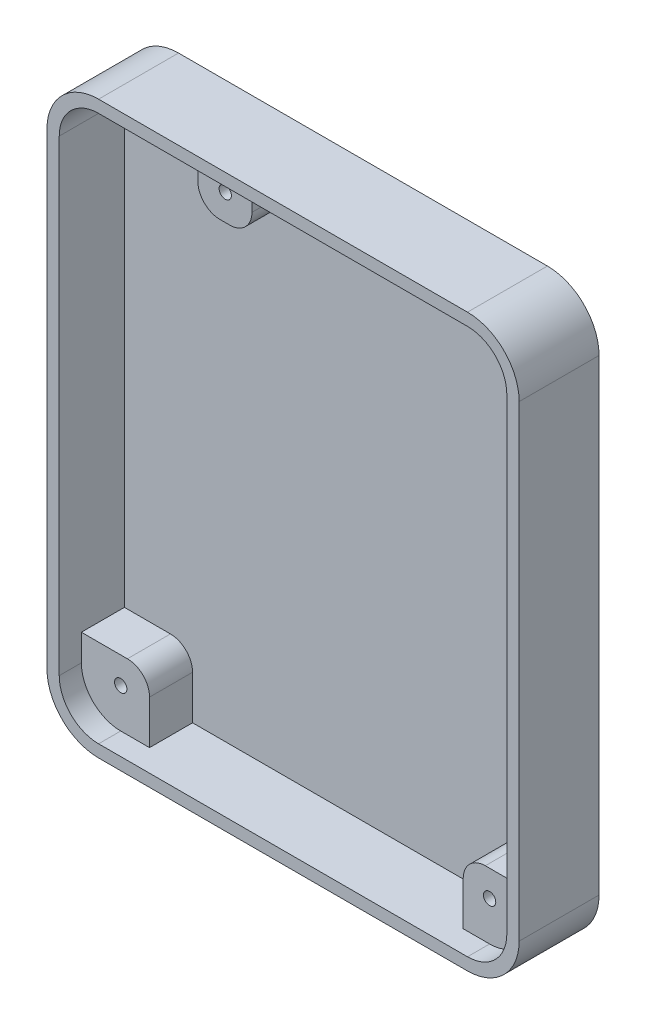
from build123d import *

# Parameters (mm, degrees)
EXTRUDE_1_DEPTH = 6.5
EXTRUDE_2_DEPTH = 1.2
SKETCH_4_R      = 0.5
EXTRUDE_3_DEPTH = 3.5


with BuildPart() as part:
    # Эскиз2 → Бобышка-Вытянуть1 (new body)
    with BuildSketch(Plane.XY):
        with BuildLine():
            Line((3.000001789, 45.2000009), (33.00000004, 45.2000009))
            ThreePointArc((33.00000004, 45.2000009), (35.969850924, 43.969847649), (37.20000166, 40.999995724))
            Line((37.20000166, 40.999995724), (37.20000166, 3.000004329))
            ThreePointArc((37.20000166, 3.000004329), (35.969850624, 0.030152951), (33.00000004, -1.2))
            Line((33.00000004, -1.2), (3.000001789, -1.2))
            ThreePointArc((3.000001789, -1.2), (0.030149154, 0.030152293), (-1.20000254, 3.000005176))
            Line((-1.20000254, 3.000005176), (-1.20000254, 40.999996571))
            ThreePointArc((-1.20000254, 40.999996571), (0.030149454, 43.969848906), (3.000001789, 45.2000009))
        make_face()
        with BuildLine():
            Line((3.000001789, 44.2000009), (33.00000004, 44.2000009))
            ThreePointArc((33.00000004, 44.2000009), (35.262743843, 43.262741167), (36.20000166, 40.999996571))
            Line((36.20000166, 40.999996571), (36.20000166, 3.000004329))
            ThreePointArc((36.20000166, 3.000004329), (35.262743843, 0.737259733), (33.00000004, -0.2))
            Line((33.00000004, -0.2), (3.000001789, -0.2))
            ThreePointArc((3.000001789, -0.2), (0.737256235, 0.737258775), (-0.20000254, 3.000004329))
            Line((-0.20000254, 3.000004329), (-0.20000254, 40.999996571))
            ThreePointArc((-0.20000254, 40.999996571), (0.737256235, 43.262742125), (3.000001789, 44.2000009))
        make_face(mode=Mode.SUBTRACT)
    extrude(amount=EXTRUDE_1_DEPTH)

    # Эскиз3 → Бобышка-Вытянуть2 (add)
    with BuildSketch(Plane.XY):
        with BuildLine():
            Line((-1.20000254, 40.999996571), (-1.20000254, 3.000005176))
            ThreePointArc((-1.20000254, 3.000005176), (0.030149154, 0.030152293), (3.000001789, -1.2))
            Line((3.000001789, -1.2), (33.00000004, -1.2))
            ThreePointArc((33.00000004, -1.2), (35.969850624, 0.030152951), (37.20000166, 3.000004329))
            Line((37.20000166, 3.000004329), (37.20000166, 40.999995724))
            ThreePointArc((37.20000166, 40.999995724), (35.969850924, 43.969847649), (33.00000004, 45.2000009))
            Line((33.00000004, 45.2000009), (3.000001789, 45.2000009))
            ThreePointArc((3.000001789, 45.2000009), (0.030149454, 43.969848906), (-1.20000254, 40.999996571))
        make_face()
    extrude(amount=EXTRUDE_2_DEPTH)

    # Эскиз4 → Бобышка-Вытянуть3 (add)
    # profile 1 of 3: a face of its own
    with BuildSketch(Plane.XY.offset(1.2)):
        with BuildLine():
            Line((9.271219031, 44.2000009), (13.669603576, 44.2000009))
            Line((13.669603576, 44.2000009), (13.669603576, 41.66326091))
            ThreePointArc((13.669603576, 41.66326091), (13.142395782, 40.390468704), (11.869603576, 39.86326091))
            Line((11.869603576, 39.86326091), (11.071219031, 39.86326091))
            ThreePointArc((11.071219031, 39.86326091), (9.798426825, 40.390468704), (9.271219031, 41.66326091))
            Line((9.271219031, 41.66326091), (9.271219031, 44.2000009))
        make_face()
        with Locations((11.49999986, 41.99999982)):
            Circle(SKETCH_4_R, mode=Mode.SUBTRACT)
    # profile 2 of 3: a face of its own
    with BuildSketch(Plane.XY.offset(1.2)):
        with BuildLine():
            Line((-0.20000254, 3.000004329), (-0.20000254, 5.158126066))
            Line((-0.20000254, 5.158126066), (3.542071928, 5.158126066))
            ThreePointArc((3.542071928, 5.158126066), (4.814864134, 4.630918272), (5.342071928, 3.358126066))
            Line((5.342071928, 3.358126066), (5.342071928, -0.2))
            Line((5.342071928, -0.2), (3.000001789, -0.2))
            ThreePointArc((3.000001789, -0.2), (0.737256235, 0.737258775), (-0.20000254, 3.000004329))
        make_face()
        with Locations((2.99999908, 3.00000162)):
            Circle(SKETCH_4_R, mode=Mode.SUBTRACT)
    # profile 3 of 3: a face of its own
    with BuildSketch(Plane.XY.offset(1.2)):
        with BuildLine():
            Line((33.00000004, -0.2), (30.851118491, -0.2))
            Line((30.851118491, -0.2), (30.851118491, 3.337368367))
            ThreePointArc((30.851118491, 3.337368367), (31.378326285, 4.610160574), (32.651118491, 5.137368367))
            Line((32.651118491, 5.137368367), (36.20000166, 5.137368367))
            Line((36.20000166, 5.137368367), (36.20000166, 3.000004329))
            ThreePointArc((36.20000166, 3.000004329), (35.262743843, 0.737259733), (33.00000004, -0.2))
        make_face()
        with Locations((33.00000004, 3.00000162)):
            Circle(SKETCH_4_R, mode=Mode.SUBTRACT)
    extrude(amount=EXTRUDE_3_DEPTH)


solid = part.part
